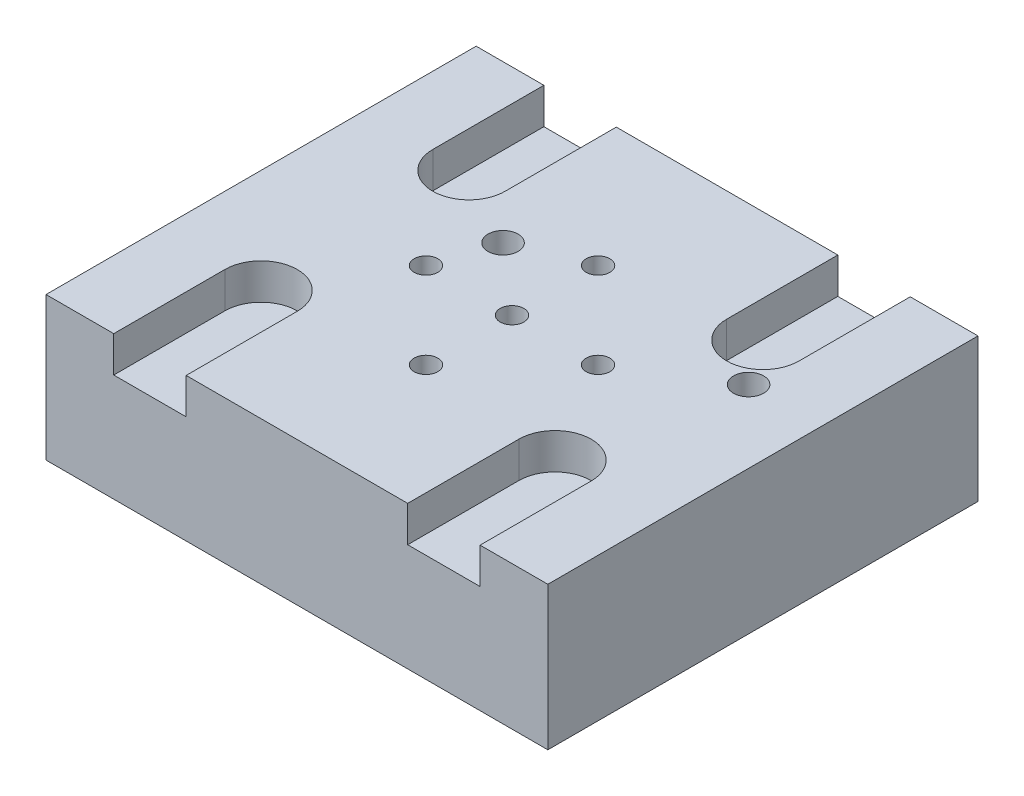
from build123d import *

# Parameters (mm, degrees)
SKETCH3_W           = 70
SKETCH3_H           = 60
BOSS_EXTRUDE3_DEPTH = 20
SKETCH4_R           = 1.65
CUT_EXTRUDE1_DEPTH  = 95.339811321
SKETCH6_R           = 2.1
CUT_EXTRUDE2_DEPTH  = 95.339811321
SKETCH9_R           = 3.25
CUT_EXTRUDE3_DEPTH  = 40.25
CUT_EXTRUDE4_START  = -3
SKETCH11_R          = 3
SKETCH11_R_2        = 1.65
CUT_EXTRUDE4_DEPTH  = 3
CHAMFER1_SIZE       = 0.8
CUT_EXTRUDE5_DEPTH  = 5


with BuildPart() as part:
    # Sketch3 → Boss-Extrude3 (new body)
    with BuildSketch(Plane(origin=(0, 0, 0), x_dir=(1, 0, 0), z_dir=(0, 1, 0))):
        with Locations((35, -30)):
            Rectangle(SKETCH3_W, SKETCH3_H)
    extrude(amount=BOSS_EXTRUDE3_DEPTH)

    # Sketch4 → Cut-Extrude1 (cut, through all)
    with BuildSketch(Plane(origin=(0, 20, 0), x_dir=(1, 0, 0), z_dir=(0, 1, 0))):
        with Locations(Location((35, -30, 0), (0, 0, 270))):
            Circle(SKETCH4_R)
        with Locations(Location((35, -18, 0), (0, 0, 270))):
            Circle(SKETCH4_R)
        with Locations(Location((47, -30, 0), (0, 0, 270))):
            Circle(SKETCH4_R)
        with Locations(Location((35, -42, 0), (0, 0, 270))):
            Circle(SKETCH4_R)
        with Locations(Location((23, -30, 0), (0, 0, 270))):
            Circle(SKETCH4_R)
    extrude(amount=-CUT_EXTRUDE1_DEPTH, mode=Mode.SUBTRACT)

    # Sketch6 → Cut-Extrude2 (cut, through all)
    with BuildSketch(Plane.XZ):
        with Locations(Location((59.875, 21.875, 0), (0, 0, 270))):
            Circle(SKETCH6_R)
        with Locations(Location((25.625, 21.875, 0), (0, 0, 270))):
            Circle(SKETCH6_R)
    extrude(amount=-CUT_EXTRUDE2_DEPTH, mode=Mode.SUBTRACT)

    # Sketch9 → Cut-Extrude3 (cut)
    with BuildSketch(Plane(origin=(0, 0, 0), x_dir=(-1, 0, 0), z_dir=(0, 0, -1))):
        with Locations((-52.525, 7.5)):
            Circle(SKETCH9_R)
        with Locations((-16.1, 7.5)):
            Circle(SKETCH9_R)
    extrude(amount=-CUT_EXTRUDE3_DEPTH, mode=Mode.SUBTRACT)

    # Sketch11 → Cut-Extrude4 (cut)
    # profile 1 of 10: a face of its own
    with BuildSketch(Plane.XZ.offset(CUT_EXTRUDE4_START)):
        with Locations(Location((35, 18, 0), (0, 0, 270))):
            Circle(SKETCH11_R)
        with Locations(Location((35, 18, 0), (0, 0, 90))):
            Circle(SKETCH11_R_2, mode=Mode.SUBTRACT)
    # profile 2 of 10: a face of its own
    with BuildSketch(Plane.XZ.offset(CUT_EXTRUDE4_START)):
        with Locations(Location((35, 30, 0), (0, 0, 270))):
            Circle(SKETCH11_R)
        with Locations(Location((35, 30, 0), (0, 0, 90))):
            Circle(SKETCH11_R_2, mode=Mode.SUBTRACT)
    # profile 3 of 10: a face of its own
    with BuildSketch(Plane.XZ.offset(CUT_EXTRUDE4_START)):
        with Locations(Location((47, 30, 0), (0, 0, 270))):
            Circle(SKETCH11_R)
        with Locations(Location((47, 30, 0), (0, 0, 90))):
            Circle(SKETCH11_R_2, mode=Mode.SUBTRACT)
    # profile 4 of 10: a face of its own
    with BuildSketch(Plane.XZ.offset(CUT_EXTRUDE4_START)):
        with Locations(Location((23, 30, 0), (0, 0, 270))):
            Circle(SKETCH11_R)
        with Locations(Location((23, 30, 0), (0, 0, 90))):
            Circle(SKETCH11_R_2, mode=Mode.SUBTRACT)
    # profile 5 of 10: a face of its own
    with BuildSketch(Plane.XZ.offset(CUT_EXTRUDE4_START)):
        with Locations(Location((35, 42, 0), (0, 0, 270))):
            Circle(SKETCH11_R)
        with Locations(Location((35, 42, 0), (0, 0, 90))):
            Circle(SKETCH11_R_2, mode=Mode.SUBTRACT)
    # profile 6 of 10: a face of its own
    with BuildSketch(Plane.XZ.offset(CUT_EXTRUDE4_START)):
        with Locations(Location((35, 42, 0), (0, 0, 90))):
            Circle(SKETCH11_R_2)
    # profile 7 of 10: a face of its own
    with BuildSketch(Plane.XZ.offset(CUT_EXTRUDE4_START)):
        with Locations(Location((23, 30, 0), (0, 0, 90))):
            Circle(SKETCH11_R_2)
    # profile 8 of 10: a face of its own
    with BuildSketch(Plane.XZ.offset(CUT_EXTRUDE4_START)):
        with Locations(Location((35, 30, 0), (0, 0, 90))):
            Circle(SKETCH11_R_2)
    # profile 9 of 10: a face of its own
    with BuildSketch(Plane.XZ.offset(CUT_EXTRUDE4_START)):
        with Locations(Location((47, 30, 0), (0, 0, 90))):
            Circle(SKETCH11_R_2)
    # profile 10 of 10: a face of its own
    with BuildSketch(Plane.XZ.offset(CUT_EXTRUDE4_START)):
        with Locations(Location((35, 18, 0), (0, 0, 90))):
            Circle(SKETCH11_R_2)
    extrude(amount=CUT_EXTRUDE4_DEPTH, mode=Mode.SUBTRACT)

    # Chamfer1
    chamfer1_edges = [part.edges().sort_by_distance(p)[0] for p in [
        (55.775, 7.5, 0),
        (19.35, 7.5, 0),
    ]]
    chamfer(chamfer1_edges, length=CHAMFER1_SIZE)

    # Sketch12 → Cut-Extrude5 (cut)
    with BuildSketch(Plane(origin=(0, 20, 0), x_dir=(1, 0, 0), z_dir=(0, 1, 0))):
        with BuildLine():
            Line((9.45, -60.104949747), (9.45, -44.5))
            ThreePointArc((9.45, -44.5), (14.5, -39.45), (19.55, -44.5))
            Line((19.55, -44.5), (19.55, -60.104949747))
            ThreePointArc((19.55, -60.104949747), (14.5, -65.154949747), (9.45, -60.104949747))
        make_face()
        with BuildLine():
            Line((60.55, -60.104949747), (60.55, -44.5))
            ThreePointArc((60.55, -44.5), (55.5, -39.45), (50.45, -44.5))
            Line((50.45, -44.5), (50.45, -60.104949747))
            ThreePointArc((50.45, -60.104949747), (55.5, -65.154949747), (60.55, -60.104949747))
        make_face()
        with BuildLine():
            Line((60.55, 0.104949747), (60.55, -15.5))
            ThreePointArc((60.55, -15.5), (55.5, -20.55), (50.45, -15.5))
            Line((50.45, -15.5), (50.45, 0.104949747))
            ThreePointArc((50.45, 0.104949747), (55.5, 5.154949747), (60.55, 0.104949747))
        make_face()
        with BuildLine():
            Line((9.45, 0.104949747), (9.45, -15.5))
            ThreePointArc((9.45, -15.5), (14.5, -20.55), (19.55, -15.5))
            Line((19.55, -15.5), (19.55, 0.104949747))
            ThreePointArc((19.55, 0.104949747), (14.5, 5.154949747), (9.45, 0.104949747))
        make_face()
    extrude(amount=-CUT_EXTRUDE5_DEPTH, mode=Mode.SUBTRACT)


solid = part.part
